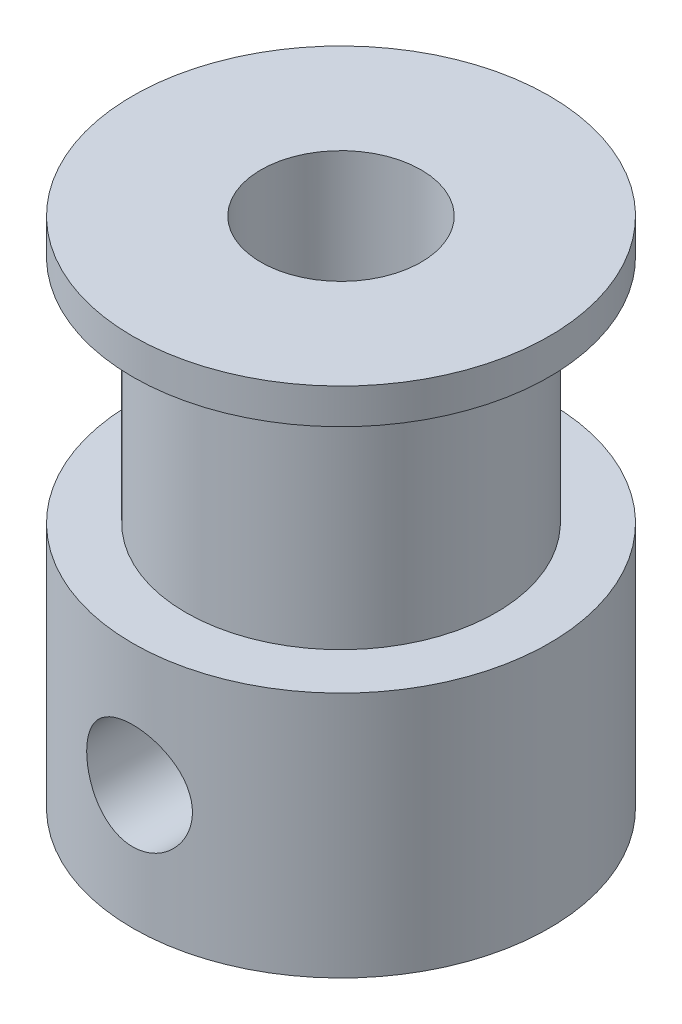
from build123d import *

# Parameters (mm, degrees)
ESQUISSE4_W                  = 1.65
ESQUISSE4_H                  = 6.5
R_P_TITION_CIRCULAIRE1_COUNT = 2
R_P_TITION_CIRCULAIRE1_ANGLE = 90


with BuildPart() as part:
    # Esquisse2 → Révolution1 (revolve)
    with BuildSketch(Plane.XY):
        Polygon((2.5, 16), (6.5, 16), (6.5, 14.9), (4.84, 14.9), (4.84, 7.7), (6.5, 7.7), (6.5, 0), (2.5, 0), align=None)
    revolve(axis=Axis((0, 0, 0), (0, 1, 0)))

    # Esquisse4 → Trou pour taraudage pour trou taraudé M41 (revolve, cut)
    with BuildSketch(Plane(origin=(0, 3.85, 0), x_dir=(0, 1, 0), z_dir=(1, 0, 0))):
        with Locations((0.825, 3.25)):
            Rectangle(ESQUISSE4_W, ESQUISSE4_H)
    trou_pour_taraudage_pour_trou_taraud_m4 = revolve(axis=Axis((0, 3.85, -6.35), (0, 0, 1)), mode=Mode.SUBTRACT)

    # Répétition circulaire1: Trou pour taraudage pour trou taraudé M41 ×2 about axis
    r_p_tition_circulaire1_axis = Axis((0, 16, 0), (0, -1, 0))
    for i in range(1, R_P_TITION_CIRCULAIRE1_COUNT):
        add(trou_pour_taraudage_pour_trou_taraud_m4.rotate(r_p_tition_circulaire1_axis, i * R_P_TITION_CIRCULAIRE1_ANGLE / (R_P_TITION_CIRCULAIRE1_COUNT - 1)), mode=Mode.SUBTRACT)


solid = part.part
